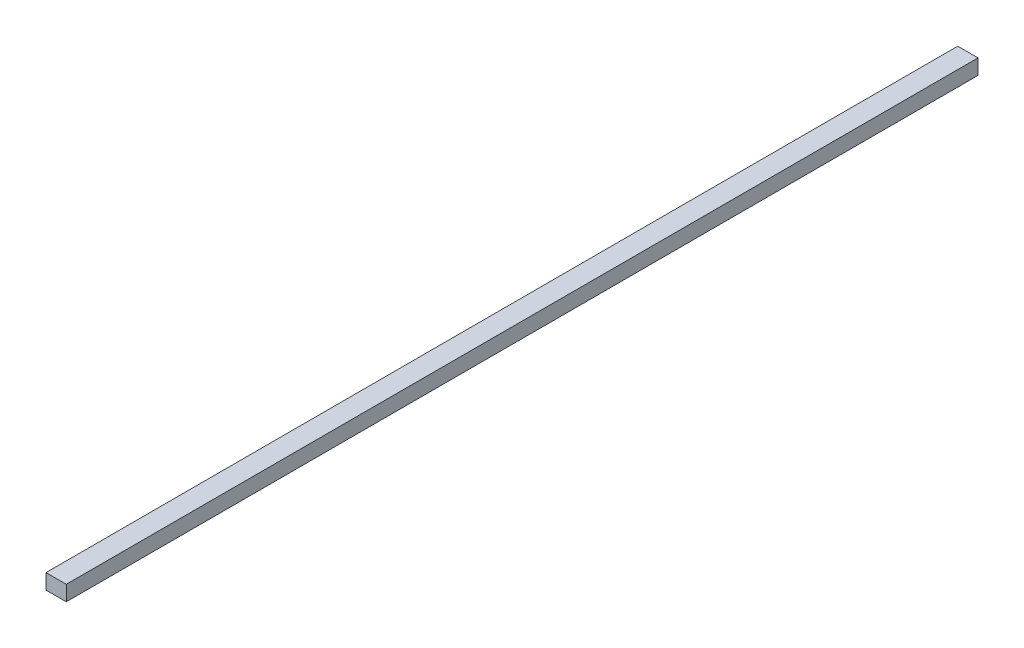
from build123d import *

# Parameters (mm, degrees)
SKETCH1_W           = 2
SKETCH1_H           = 1.5
BOSS_EXTRUDE1_DEPTH = 90
SCALE1_SCALE        = 10


with BuildPart() as part:
    # Sketch1 → Boss-Extrude1 (new body)
    with BuildSketch(Plane.XY):
        with Locations((1, 0.75)):
            Rectangle(SKETCH1_W, SKETCH1_H)
    extrude(amount=BOSS_EXTRUDE1_DEPTH)


with BuildPart() as part_1:
    # Scale1: scaled about (0, 0, 0)
    add(part.part.scale(SCALE1_SCALE))


solid = part_1.part
